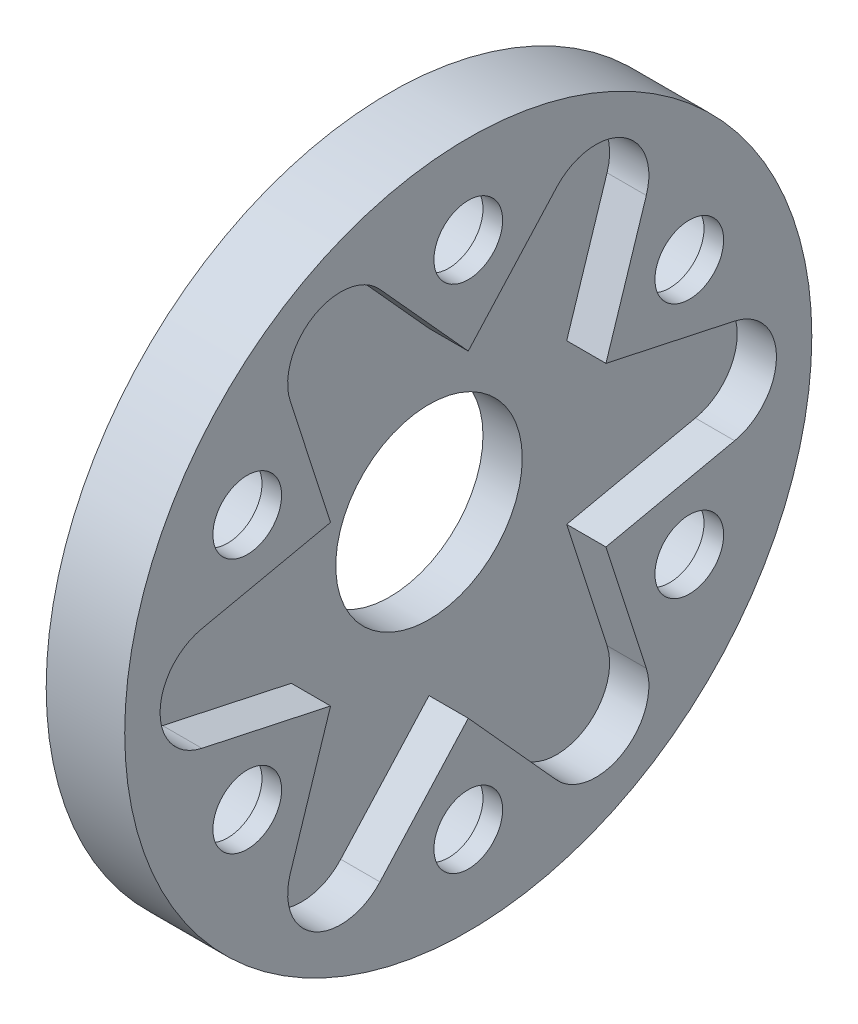
from build123d import *

# Parameters (mm, degrees)
SKETCH1_R           = 17.5
SKETCH1_R_2         = 4.75
BOSS_EXTRUDE1_DEPTH = 4
CUT_EXTRUDE1_DEPTH  = 2
SKETCH3_R           = 1.75
CUT_EXTRUDE2_DEPTH  = 26.069902273
SKETCH4_R           = 3
CUT_EXTRUDE3_DEPTH  = 3


with BuildPart() as part:
    # Sketch1 → Boss-Extrude1 (new body)
    with BuildSketch(Plane(origin=(0, 0, 0), x_dir=(0, 0, -1), z_dir=(1, 0, 0))):
        Circle(SKETCH1_R)
        Circle(SKETCH1_R_2, mode=Mode.SUBTRACT)
    extrude(amount=BOSS_EXTRUDE1_DEPTH)

    # Sketch2 → Cut-Extrude1 (cut)
    with BuildSketch(Plane(origin=(4, 0, 0), x_dir=(0, 0, -1), z_dir=(1, 0, 0))):
        with BuildLine():
            Line((13.567828444, -2.639615665), (7.013907066, -4.049481133))
            Line((7.013907066, -4.049481133), (9.069888444, -10.430276274))
            ThreePointArc((9.069888444, -10.430276274), (7.85, -13.596598839), (4.49794, -13.069891939))
            Line((4.49794, -13.069891939), (0, -8.098962266))
            Line((0, -8.098962266), (-4.49794, -13.069891939))
            ThreePointArc((-4.49794, -13.069891939), (-7.85, -13.596598839), (-9.069888444, -10.430276274))
            Line((-9.069888444, -10.430276274), (-7.013907066, -4.049481133))
            Line((-7.013907066, -4.049481133), (-13.567828444, -2.639615665))
            ThreePointArc((-13.567828444, -2.639615665), (-15.7, 0), (-13.567828444, 2.639615665))
            Line((-13.567828444, 2.639615665), (-7.013907066, 4.049481133))
            Line((-7.013907066, 4.049481133), (-9.069888444, 10.430276274))
            ThreePointArc((-9.069888444, 10.430276274), (-7.85, 13.596598839), (-4.49794, 13.069891939))
            Line((-4.49794, 13.069891939), (0, 8.098962266))
            Line((0, 8.098962266), (4.49794, 13.069891939))
            ThreePointArc((4.49794, 13.069891939), (7.85, 13.596598839), (9.069888444, 10.430276274))
            Line((9.069888444, 10.430276274), (7.013907066, 4.049481133))
            Line((7.013907066, 4.049481133), (13.567828444, 2.639615665))
            ThreePointArc((13.567828444, 2.639615665), (15.7, 0), (13.567828444, -2.639615665))
        make_face()
    extrude(amount=-CUT_EXTRUDE1_DEPTH, mode=Mode.SUBTRACT)

    # Sketch3 → Cut-Extrude2 (cut, through all)
    with BuildSketch(Plane(origin=(4, 0, 0), x_dir=(0, 0, -1), z_dir=(1, 0, 0))):
        with Locations((0, 13)):
            Circle(SKETCH3_R)
        with Locations((11.258330249, 6.5)):
            Circle(SKETCH3_R)
        with Locations((11.258330249, -6.5)):
            Circle(SKETCH3_R)
        with Locations((0, -13)):
            Circle(SKETCH3_R)
        with Locations((-11.258330249, -6.5)):
            Circle(SKETCH3_R)
        with Locations((-11.258330249, 6.5)):
            Circle(SKETCH3_R)
    extrude(amount=-CUT_EXTRUDE2_DEPTH, mode=Mode.SUBTRACT)

    # Sketch4 → Cut-Extrude3 (cut)
    with BuildSketch(Plane.ZY):
        with Locations((-11.258330249, 6.5)):
            Circle(SKETCH4_R)
        with Locations((0, 13)):
            Circle(SKETCH4_R)
        with Locations((11.258330249, 6.5)):
            Circle(SKETCH4_R)
        with Locations((11.258330249, -6.5)):
            Circle(SKETCH4_R)
        with Locations((0, -13)):
            Circle(SKETCH4_R)
        with Locations((-11.258330249, -6.5)):
            Circle(SKETCH4_R)
    extrude(amount=-CUT_EXTRUDE3_DEPTH, mode=Mode.SUBTRACT)


solid = part.part
